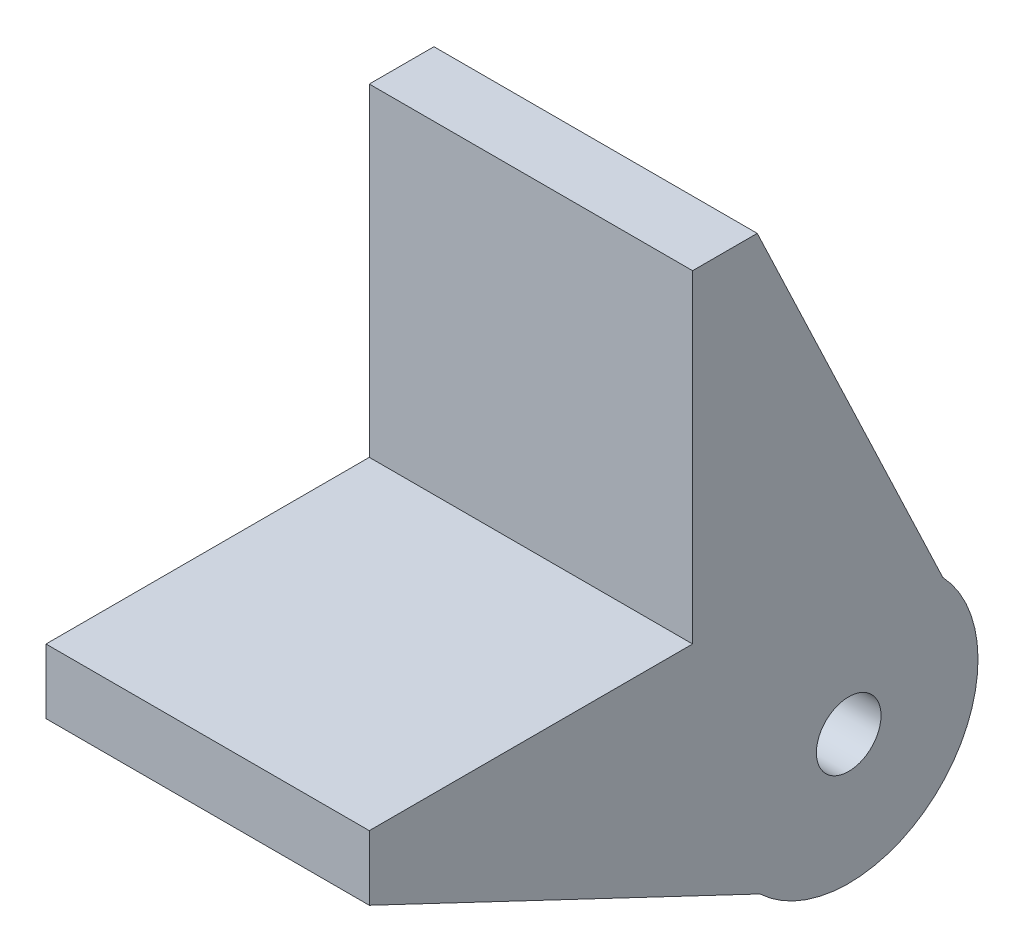
from build123d import *

# Parameters (mm, degrees)
SKETCH_1_W          = 10
SKETCH_1_H          = 10
EXTRUDE_1_DEPTH     = 2
SKETCH_2_W          = 10
SKETCH_2_H          = 12
EXTRUDE_2_DEPTH     = 2
EXTRUDE_4_DEPTH     = 2
EXTRUDE_START       = -2
EXTRUDE_5_DEPTH     = 2
SKETCH_5_R          = 1
CUT_EXTRUDE_1_DEPTH = 10


with BuildPart() as part:
    # 草图1 → 凸台-拉伸1 (new body)
    with BuildSketch(Plane.XY):
        with Locations((5, 5)):
            Rectangle(SKETCH_1_W, SKETCH_1_H)
    extrude(amount=EXTRUDE_1_DEPTH)

    # 草图2 → 凸台-拉伸2 (add)
    with BuildSketch(Plane.XZ):
        with Locations((5, 6)):
            Rectangle(SKETCH_2_W, SKETCH_2_H)
    extrude(amount=EXTRUDE_2_DEPTH)

    # 草图3 → 凸台-拉伸4 (add)
    with BuildSketch(Plane(origin=(10, 0, 0), x_dir=(0, 0, -1), z_dir=(1, 0, 0))):
        with BuildLine():
            Line((0, -2), (-12, -2))
            Line((-12, -2), (0.083847107, -7.738286318))
            ThreePointArc((0.083847107, -7.738286318), (5.656854249, -7.656854249), (5.738286318, -2.083847107))
            Line((5.738286318, -2.083847107), (0, 10))
            Line((0, 10), (0, -2))
        make_face()
    extrude(amount=-EXTRUDE_4_DEPTH)

    # 草图4 → 凸台-拉伸5 (add)
    with BuildSketch(Plane.ZY.offset(EXTRUDE_START)):
        with BuildLine():
            Line((0, -2), (0, 10))
            Line((0, 10), (-5.738286318, -2.083847107))
            ThreePointArc((-5.738286318, -2.083847107), (-5.656854249, -7.656854249), (-0.083847107, -7.738286318))
            Line((-0.083847107, -7.738286318), (12, -2))
            Line((12, -2), (0, -2))
        make_face()
    extrude(amount=EXTRUDE_5_DEPTH)

    # 草图5 → 切除-拉伸1 (cut)
    with BuildSketch(Plane(origin=(10, 0, 0), x_dir=(0, 0, -1), z_dir=(1, 0, 0))):
        with Locations((2.828427125, -4.828427125)):
            Circle(SKETCH_5_R)
    extrude(amount=-CUT_EXTRUDE_1_DEPTH, mode=Mode.SUBTRACT)


solid = part.part
